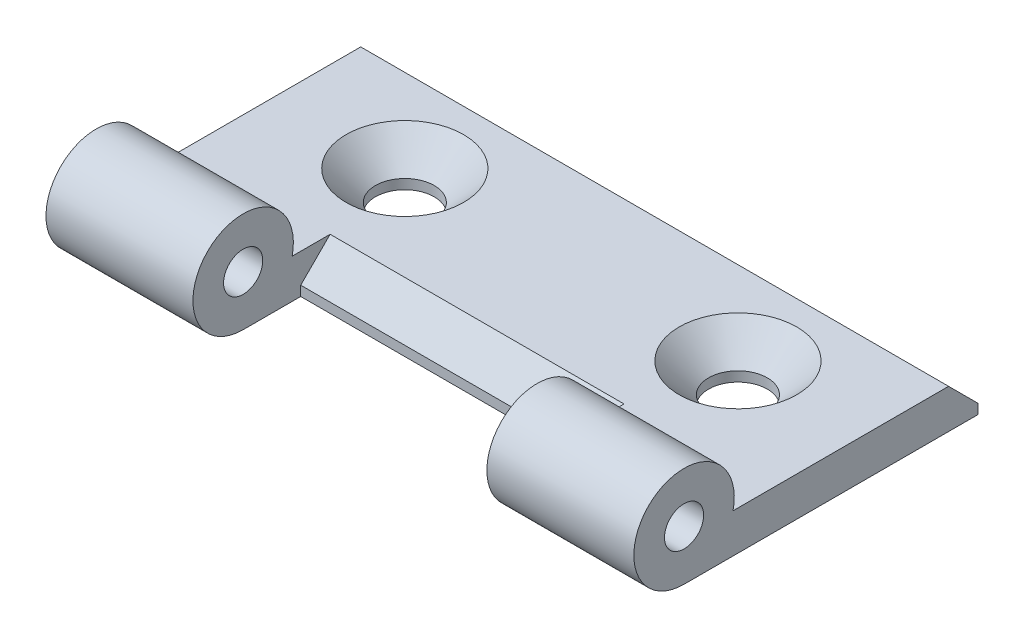
from build123d import *

# Parameters (mm, degrees)
SKETCH_1_R          = 2
EXTRUDE_1_DEPTH     = 30
SKETCH_2_R          = 3
SKETCH_2_W          = 30
SKETCH_2_H          = 11
CUT_EXTRUDE_1_DEPTH = 44.647021662
CHAMFER_1_SIZE      = 3


with BuildPart() as part:
    # 草图1 → 凸台-拉伸1 (new, symmetric)
    with BuildSketch(Plane(origin=(0, 0, 0), x_dir=(0, 0, -1), z_dir=(1, 0, 0))):
        with BuildLine():
            Line((0, 0), (30, 0))
            Line((30, 0), (30, 4))
            Line((30, 4), (5, 4))
            ThreePointArc((5, 4), (-3.201562119, 9.126952648), (0, 0))
        make_face()
        with Locations((0, 5.125)):
            Circle(SKETCH_1_R, mode=Mode.SUBTRACT)
    extrude(amount=EXTRUDE_1_DEPTH, both=True)

    # 草图2 → 切除-拉伸1 (cut, through all)
    with BuildSketch(Plane(origin=(0, 0, 0), x_dir=(1, 0, 0), z_dir=(0, 1, 0))):
        with Locations(Location((-17, 18.5, 0), (0, 0, 90))):
            Circle(SKETCH_2_R)
        with Locations(Location((17, 18.5, 0), (0, 0, 90))):
            Circle(SKETCH_2_R)
        with Locations((0, 0.375)):
            Rectangle(SKETCH_2_W, SKETCH_2_H)
    extrude(amount=CUT_EXTRUDE_1_DEPTH, mode=Mode.SUBTRACT)

    # 倒角1
    chamfer_1_edges = [part.edges().sort_by_distance(p)[0] for p in [
        (0, 4, -5.875),
        (17, 4, -15.5),
        (-17, 4, -15.5),
        (0, 4, -30),
    ]]
    chamfer(chamfer_1_edges, length=CHAMFER_1_SIZE)


solid = part.part
